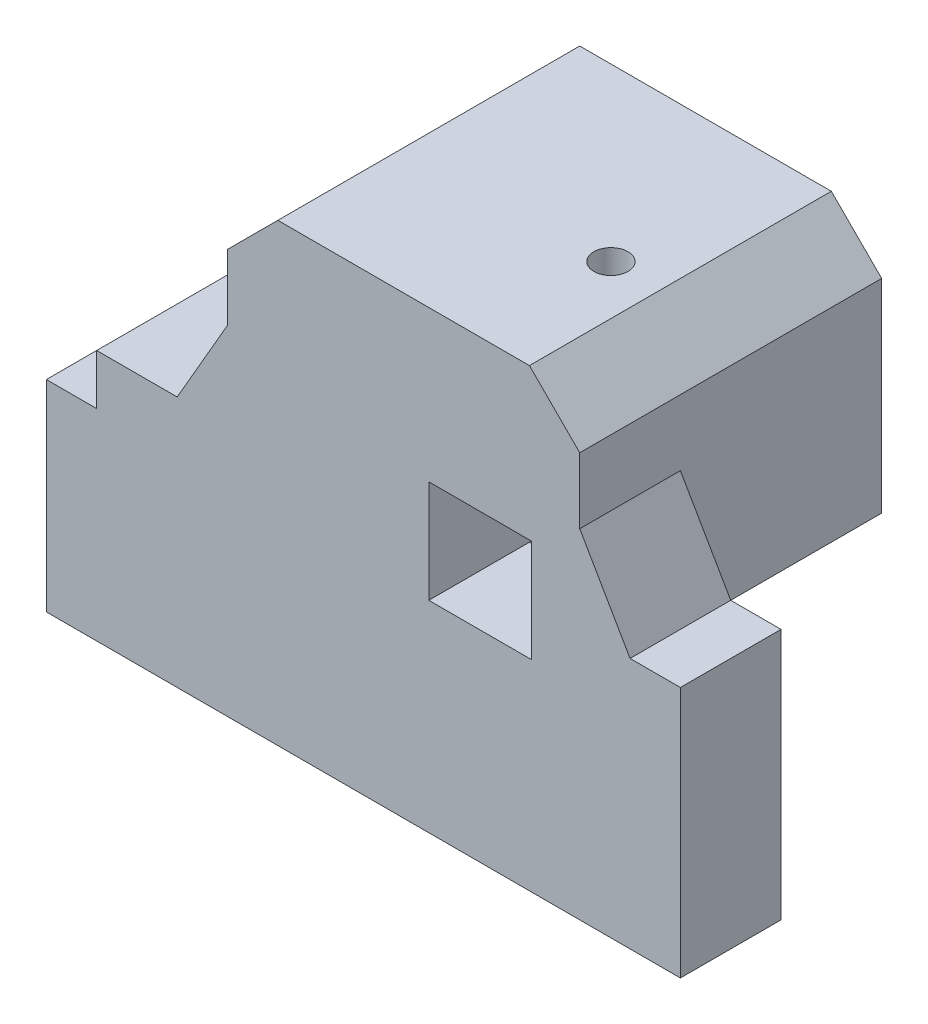
from build123d import *
from OCP.BRepFilletAPI import BRepFilletAPI_MakeChamfer

# Parameters (mm, degrees)
SZKIC1_W                        = 58
SZKIC1_H                        = 20
DODANIE_WYCI_GNI_CIE1_DEPTH     = 5
SZKIC2_W                        = 15
SZKIC2_H                        = 5
DODANIE_WYCI_GNI_CIE2_DEPTH     = 58
DODANIE_WYCI_GNI_CIE3_DEPTH     = 20
DODANIE_WYCI_GNI_CIE4_DEPTH     = 10
WYTNIJ_WYCI_GNI_CIE2_DEPTH      = 50.950375374
WYTNIJ_WYCI_GNI_CIE2_DEPTH_BACK = 50.950375374
SZKIC6_W                        = 58
SZKIC6_H                        = 5
DODANIE_WYCI_GNI_CIE5_DEPTH     = 20
SZKIC7_R                        = 2
WYTNIJ_WYCI_GNI_CIE3_DEPTH      = 10
DODANIE_WYCI_GNI_CIE8_DEPTH     = 10
SZKIC11_W                       = 10.2
SZKIC11_H                       = 10.2
DODANIE_WYCI_GNI_CIE9_DEPTH     = 5
SFAZOWANIE2_SIZE                = 5
SZKIC12_W                       = 10
SZKIC12_H                       = 20
WYTNIJ_WYCI_GNI_CIE4_DEPTH      = 10
SZKIC13_R                       = 1.7
WYTNIJ_WYCI_GNI_CIE5_DEPTH      = 60.991999467
DODANIE_WYCI_GNI_CIE11_DEPTH    = 5
SFAZOWANIE6_SIZE                = 5
SFAZOWANIE6_SIZE2               = 8.660254038


with BuildPart() as part:
    # Szkic1 → Dodanie-wyciągnięcie1 (new body)
    with BuildSketch(Plane.XY):
        Rectangle(SZKIC1_W, SZKIC1_H)
    extrude(amount=DODANIE_WYCI_GNI_CIE1_DEPTH)

    # Szkic2 → Dodanie-wyciągnięcie2 (add)
    with BuildSketch(Plane(origin=(29, 0, 0), x_dir=(0, 0, -1), z_dir=(1, 0, 0))):
        with Locations((-2.5, 12.5)):
            Rectangle(SZKIC2_W, SZKIC2_H)
    extrude(amount=-DODANIE_WYCI_GNI_CIE2_DEPTH)

    # Szkic3 → Dodanie-wyciągnięcie3 (add)
    with BuildSketch(Plane.XZ.offset(10)):
        Polygon((-34, 5), (-29, 0), (-29, 5), (-24, 5), (-29, 10), (-34, 10), align=None)
    extrude(amount=-DODANIE_WYCI_GNI_CIE3_DEPTH)

    # Szkic5 → Dodanie-wyciągnięcie4 (add)
    with BuildSketch(Plane.XY.offset(5)):
        Polygon((14.2, 20.2), (14.2, 10), (19, 10), (19, 35.2), (-16, 35.2), (-16, 10), (4, 10), (4, 20.2), align=None)
    extrude(amount=-DODANIE_WYCI_GNI_CIE4_DEPTH)

    # Szkic5<3> → Wytnij-wyciągnięcie2 (cut, two sides: drawn at the far end of the back side and taken through both)
    with BuildSketch(Plane.XY.offset(5).offset(-WYTNIJ_WYCI_GNI_CIE2_DEPTH_BACK)):
        Polygon((4, 10), (14.2, 10), (14.2, 15), (14.2, 20.2), (4, 20.2), (4, 15), align=None)
    extrude(amount=WYTNIJ_WYCI_GNI_CIE2_DEPTH + WYTNIJ_WYCI_GNI_CIE2_DEPTH_BACK, mode=Mode.SUBTRACT)

    # Szkic6 → Dodanie-wyciągnięcie5 (add)
    with BuildSketch(Plane(origin=(0, 10, 0), x_dir=(1, 0, 0), z_dir=(0, 1, 0))):
        with Locations((0, -7.5)):
            Rectangle(SZKIC6_W, SZKIC6_H)
    extrude(amount=-DODANIE_WYCI_GNI_CIE5_DEPTH)

    # Szkic7 → Wytnij-wyciągnięcie3 (cut)
    with BuildSketch(Plane.XZ.offset(10)):
        with Locations(Location((-19, 5, 0), (0, 0, 270))):
            Circle(SZKIC7_R)
        with Locations(Location((11, 5, 0), (0, 0, 270))):
            Circle(SZKIC7_R)
    extrude(amount=-WYTNIJ_WYCI_GNI_CIE3_DEPTH, mode=Mode.SUBTRACT)

    # Szkic10 → Dodanie-wyciągnięcie8 (add)
    with BuildSketch(Plane(origin=(0, 0, -5), x_dir=(-1, 0, 0), z_dir=(0, 0, -1))):
        Polygon((16, 10), (16, 15), (16, 35.2), (-19, 35.2), (-19, 15), (-29, 15), (-29, 10), (-14.2, 10), (-14.2, 20.2), (-4, 20.2), (-4, 10), align=None)
    extrude(amount=DODANIE_WYCI_GNI_CIE8_DEPTH)

    # Szkic11 → Dodanie-wyciągnięcie9 (add)
    with BuildSketch(Plane(origin=(0, 0, -15), x_dir=(-1, 0, 0), z_dir=(0, 0, -1))):
        with Locations((-9.1, 15.1)):
            Rectangle(SZKIC11_W, SZKIC11_H)
        Polygon((-29, 10), (-14.2, 10), (-14.2, 20.2), (-4, 20.2), (-4, 10), (16, 10), (16, 35.2), (-19, 35.2), (-19, 15), (-29, 15), align=None)
    extrude(amount=DODANIE_WYCI_GNI_CIE9_DEPTH)

    # Sfazowanie2
    sfazowanie2_edges = [part.edges().sort_by_distance(p)[0] for p in [
        (-16, 35.2, -7.5),
        (19, 35.2, -7.5),
    ]]
    chamfer(sfazowanie2_edges, length=SFAZOWANIE2_SIZE)

    # Szkic12 → Wytnij-wyciągnięcie4 (cut)
    with BuildSketch(Plane.XZ.offset(-10)):
        with Locations((24, -10)):
            Rectangle(SZKIC12_W, SZKIC12_H)
    extrude(amount=-WYTNIJ_WYCI_GNI_CIE4_DEPTH, mode=Mode.SUBTRACT)

    # Szkic13 → Wytnij-wyciągnięcie5 (cut, through all)
    with BuildSketch(Plane(origin=(0, 35.2, 0), x_dir=(1, 0, 0), z_dir=(0, 1, 0))):
        with Locations(Location((9.1, 3, 0), (0, 0, 270))):
            Circle(SZKIC13_R)
    extrude(amount=-WYTNIJ_WYCI_GNI_CIE5_DEPTH, mode=Mode.SUBTRACT)

    # Szkic15 → Dodanie-wyciągnięcie11 (add)
    with BuildSketch(Plane.XY.offset(5)):
        Polygon((19, 15), (19, 30.2), (14, 35.2), (-11, 35.2), (-16, 30.2), (-16, 15), (4, 15), (4, 20.2), (14.2, 20.2), (14.2, 15), align=None)
    extrude(amount=DODANIE_WYCI_GNI_CIE11_DEPTH)

    # Sfazowanie6: one chamfer whose edges measure the first distance from different faces: ONE call of the kernel's chamfer builder (chamfer() names one face for all edges)
    sfazowanie6_edges_1 = [part.edges().sort_by_distance(p)[0] for p in [
        (-16, 15, 2.5),
    ]]
    sfazowanie6_side_1 = [part.faces().sort_by_distance(p)[0] for p in [
        (-22.5, 15, 2.5),
    ]]
    sfazowanie6_edges_2 = [part.edges().sort_by_distance(p)[0] for p in [
        (19, 15, 5),
    ]]
    sfazowanie6_side_2 = [part.faces().sort_by_distance(p)[0] for p in [
        (24, 15, 5),
    ]]
    sfazowanie6 = BRepFilletAPI_MakeChamfer(part.part.solid().wrapped)
    for e in sfazowanie6_edges_1:
        sfazowanie6.Add(SFAZOWANIE6_SIZE, SFAZOWANIE6_SIZE2, e.wrapped, sfazowanie6_side_1[0].wrapped)  # the first distance lies on this face
    for e in sfazowanie6_edges_2:
        sfazowanie6.Add(SFAZOWANIE6_SIZE, SFAZOWANIE6_SIZE2, e.wrapped, sfazowanie6_side_2[0].wrapped)  # the first distance lies on this face
    add(Compound.cast(sfazowanie6.Shape()), mode=Mode.REPLACE)


solid = part.part
